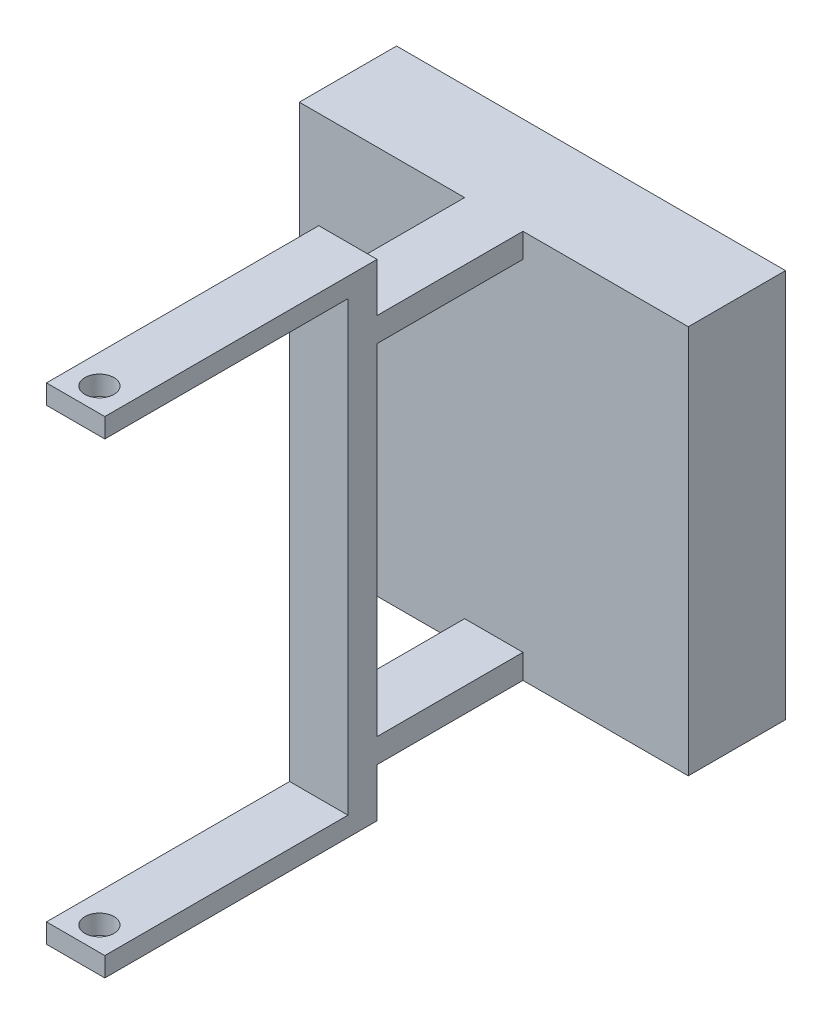
from build123d import *

# Parameters (mm, degrees)
SKETCH1_W           = 40
SKETCH1_H           = 40
BOSS_EXTRUDE1_DEPTH = 10
BOSS_EXTRUDE2_DEPTH = 15
SKETCH6_W           = 6
SKETCH6_H           = 50
BOSS_EXTRUDE4_DEPTH = 3
SKETCH7_W           = 6
SKETCH7_H           = 2
BOSS_EXTRUDE5_DEPTH = 25
SKETCH8_R           = 1.5
CUT_EXTRUDE1_DEPTH  = 65
SKETCH10_R          = 10
BOSS_EXTRUDE7_DEPTH = 5


with BuildPart() as part:
    # Sketch1 → Boss-Extrude1 (new body)
    with BuildSketch(Plane.XY):
        Rectangle(SKETCH1_W, SKETCH1_H)
    extrude(amount=BOSS_EXTRUDE1_DEPTH)

    # Sketch2 → Boss-Extrude2 (add)
    with BuildSketch(Plane.XY.offset(10)):
        Polygon((0, -20), (3, -20), (3, -17.5), (-3, -17.5), (-3, -20), align=None)
    boss_extrude2 = extrude(amount=BOSS_EXTRUDE2_DEPTH)

    # Mirror1: Boss-Extrude2 across plane
    add(boss_extrude2.mirror(Plane.ZX))

    # Sketch6 → Boss-Extrude4 (add)
    with BuildSketch(Plane.XY.offset(25)):
        Rectangle(SKETCH6_W, SKETCH6_H)
    extrude(amount=BOSS_EXTRUDE4_DEPTH)

    # Sketch7 → Boss-Extrude5 (add)
    with BuildSketch(Plane.XY.offset(28)):
        with Locations((0, -24)):
            Rectangle(SKETCH7_W, SKETCH7_H)
    boss_extrude5 = extrude(amount=BOSS_EXTRUDE5_DEPTH)

    # Mirror2: Boss-Extrude5 across plane
    add(boss_extrude5.mirror(Plane.ZX))

    # Sketch8 → Cut-Extrude1 (cut)
    with BuildSketch(Plane.XZ.offset(25)):
        with Locations(Location((0, 50.555661978, 0), (0, 0, 270))):
            Circle(SKETCH8_R)
    extrude(amount=-CUT_EXTRUDE1_DEPTH, mode=Mode.SUBTRACT)

    # Sketch10 → Boss-Extrude7 (add)
    with BuildSketch(Plane(origin=(0, 0, 0), x_dir=(-1, 0, 0), z_dir=(0, 0, -1))):
        Circle(SKETCH10_R)
    extrude(amount=BOSS_EXTRUDE7_DEPTH)


solid = part.part
